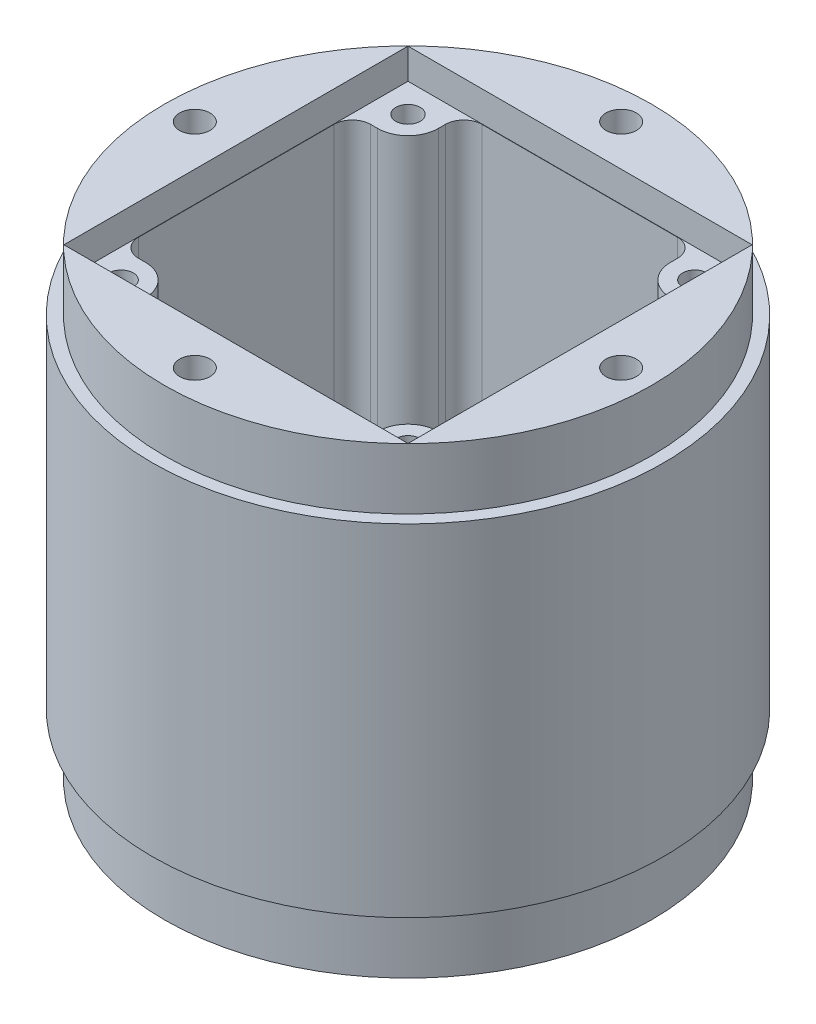
from build123d import *

# Parameters (mm, degrees)
SKETCH2_R           = 40
BOSS_EXTRUDE1_DEPTH = 76
SKETCH3_W           = 8
SKETCH3_H           = 20
CUT_EXTRUDE1_DEPTH  = 3
SKETCH4_R           = 42
SKETCH4_R_2         = 40
BOSS_EXTRUDE3_DEPTH = 28
SKETCH5_W           = 56.5
SKETCH5_H           = 56.5
CUT_EXTRUDE7_DEPTH  = 5
SKETCH6_R           = 2
CUT_EXTRUDE8_DEPTH  = 93.568893263
SKETCH7_R           = 2.5
CUT_EXTRUDE9_DEPTH  = 97.457244414


with BuildPart() as part:
    # Sketch2 → Boss-Extrude1 (new body)
    with BuildSketch(Plane(origin=(0, 0, 0), x_dir=(1, 0, 0), z_dir=(0, 1, 0))):
        with Locations(Location((0, 0, 0), (0, 0, 270))):
            Circle(SKETCH2_R)
        with BuildLine():
            Line((-16.05, 28.2), (16.05, 28.2))
            ThreePointArc((16.05, 28.2), (18.171320344, 27.321320344), (19.05, 25.2))
            Line((19.05, 25.2), (19.05, 24.05))
            ThreePointArc((19.05, 24.05), (20.514466094, 20.514466094), (24.05, 19.05))
            Line((24.05, 19.05), (25.2, 19.05))
            ThreePointArc((25.2, 19.05), (27.321320344, 18.171320344), (28.2, 16.05))
            Line((28.2, 16.05), (28.2, -16.05))
            ThreePointArc((28.2, -16.05), (27.321320344, -18.171320344), (25.2, -19.05))
            Line((25.2, -19.05), (24.05, -19.05))
            ThreePointArc((24.05, -19.05), (20.514466094, -20.514466094), (19.05, -24.05))
            Line((19.05, -24.05), (19.05, -25.2))
            ThreePointArc((19.05, -25.2), (18.171320344, -27.321320344), (16.05, -28.2))
            Line((16.05, -28.2), (-16.05, -28.2))
            ThreePointArc((-16.05, -28.2), (-18.171320344, -27.321320344), (-19.05, -25.2))
            Line((-19.05, -25.2), (-19.05, -24.05))
            ThreePointArc((-19.05, -24.05), (-20.514466094, -20.514466094), (-24.05, -19.05))
            Line((-24.05, -19.05), (-25.2, -19.05))
            ThreePointArc((-25.2, -19.05), (-27.321320344, -18.171320344), (-28.2, -16.05))
            Line((-28.2, -16.05), (-28.2, 16.05))
            ThreePointArc((-28.2, 16.05), (-27.321320344, 18.171320344), (-25.2, 19.05))
            Line((-25.2, 19.05), (-24.05, 19.05))
            ThreePointArc((-24.05, 19.05), (-20.514466094, 20.514466094), (-19.05, 24.05))
            Line((-19.05, 24.05), (-19.05, 25.2))
            ThreePointArc((-19.05, 25.2), (-18.171320344, 27.321320344), (-16.05, 28.2))
        make_face(mode=Mode.SUBTRACT)
    extrude(amount=BOSS_EXTRUDE1_DEPTH)

    # Sketch3 → Cut-Extrude1 (cut)
    with BuildSketch(Plane(origin=(0, 0, 28.2), x_dir=(-1, 0, 0), z_dir=(0, 0, -1))):
        with Locations((0, 10)):
            Rectangle(SKETCH3_W, SKETCH3_H)
    extrude(amount=-CUT_EXTRUDE1_DEPTH, mode=Mode.SUBTRACT)

    # Sketch4 → Boss-Extrude3 (add, symmetric)
    with BuildSketch(Plane(origin=(0, 38, 0), x_dir=(1, 0, 0), z_dir=(0, 1, 0))):
        with Locations(Location((0, 0, 0), (0, 0, 270))):
            Circle(SKETCH4_R)
        with Locations(Location((0, 0, 0), (0, 0, 270))):
            Circle(SKETCH4_R_2, mode=Mode.SUBTRACT)
    extrude(amount=BOSS_EXTRUDE3_DEPTH, both=True)

    # Sketch5 → Cut-Extrude7 (cut)
    with BuildSketch(Plane(origin=(0, 76, 0), x_dir=(1, 0, 0), z_dir=(0, 1, 0))):
        Rectangle(SKETCH5_W, SKETCH5_H)
    extrude(amount=-CUT_EXTRUDE7_DEPTH, mode=Mode.SUBTRACT)

    # Sketch6 → Cut-Extrude8 (cut, through all)
    with BuildSketch(Plane(origin=(0, 71, 0), x_dir=(1, 0, 0), z_dir=(0, 1, 0))):
        with Locations(Location((-23.55, 23.55, 0), (0, 0, 270))):
            Circle(SKETCH6_R)
        with Locations(Location((23.55, 23.55, 0), (0, 0, 270))):
            Circle(SKETCH6_R)
        with Locations(Location((23.55, -23.55, 0), (0, 0, 270))):
            Circle(SKETCH6_R)
        with Locations(Location((-23.55, -23.55, 0), (0, 0, 270))):
            Circle(SKETCH6_R)
    extrude(amount=-CUT_EXTRUDE8_DEPTH, mode=Mode.SUBTRACT)

    # Sketch7 → Cut-Extrude9 (cut, through all)
    with BuildSketch(Plane(origin=(0, 76, 0), x_dir=(1, 0, 0), z_dir=(0, 1, 0))):
        with Locations(Location((0, 35, 0), (0, 0, 270))):
            Circle(SKETCH7_R)
        with Locations(Location((35, 0, 0), (0, 0, 270))):
            Circle(SKETCH7_R)
        with Locations(Location((0, -35, 0), (0, 0, 270))):
            Circle(SKETCH7_R)
        with Locations(Location((-35, 0, 0), (0, 0, 270))):
            Circle(SKETCH7_R)
    extrude(amount=-CUT_EXTRUDE9_DEPTH, mode=Mode.SUBTRACT)


solid = part.part
